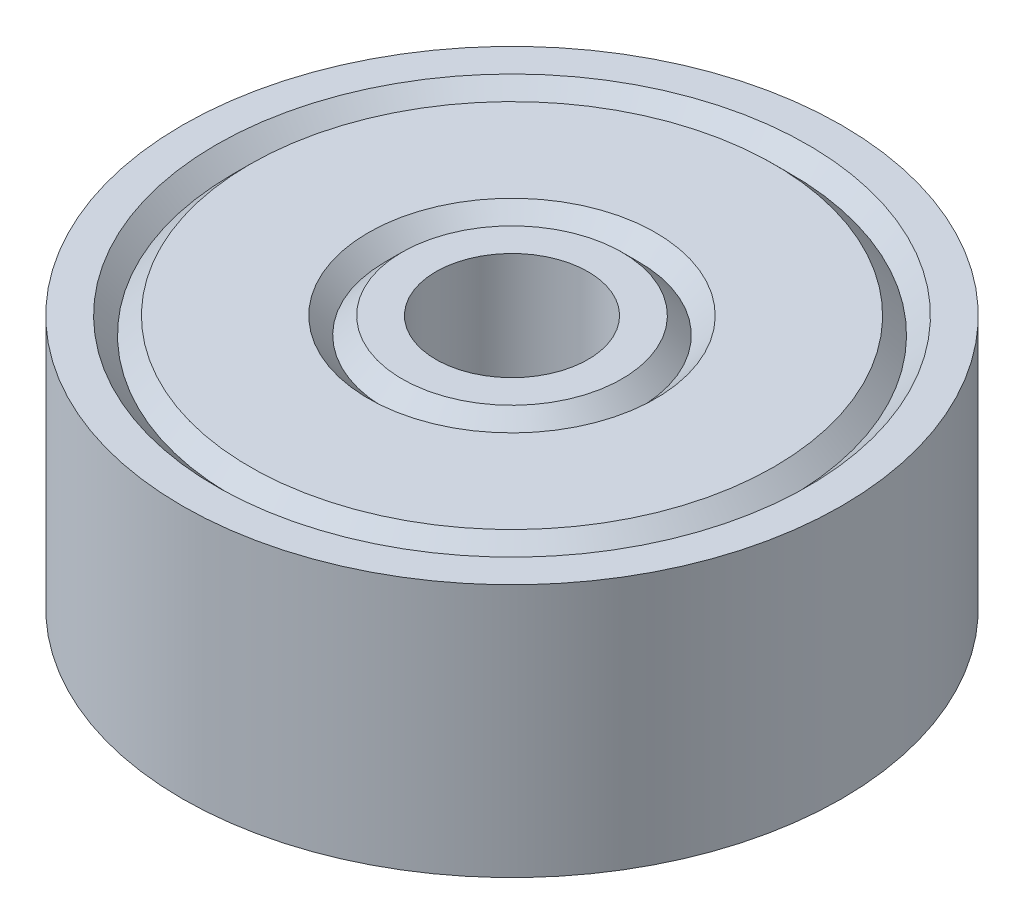
from build123d import *


with BuildPart() as part:
    # Sketch1 → Revolve1 (revolve)
    with BuildSketch(Plane.XY):
        Polygon((-1.5, 2.5), (-2.166666667, 2.5), (-2.5, 2.166666667), (-2.833333333, 2.5), (-5.166666667, 2.5), (-5.5, 2.166666667), (-5.833333333, 2.5), (-6.5, 2.5), (-6.5, -2.5), (-5.833333333, -2.5), (-5.5, -2.166666667), (-5.166666667, -2.5), (-2.833333333, -2.5), (-2.5, -2.166666667), (-2.166666667, -2.5), (-1.5, -2.5), align=None)
    revolve(axis=Axis((0, 2.5, 0), (0, -1, 0)))


solid = part.part
